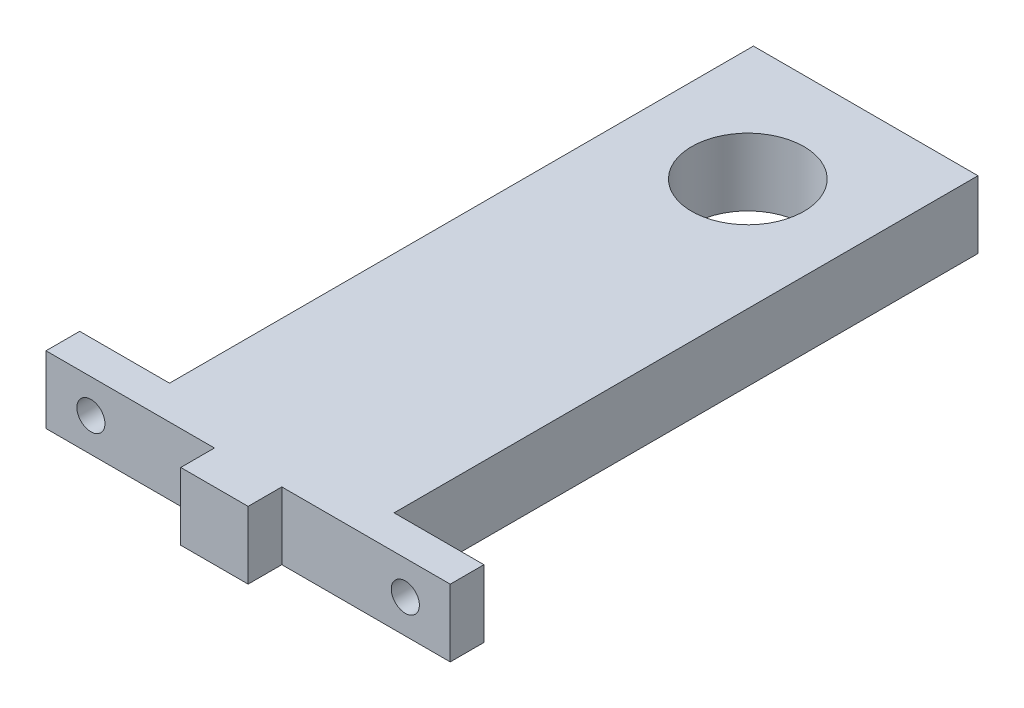
from build123d import *

# Parameters (mm, degrees)
EXTRUDE_1_DEPTH          = 6
SKETCH_3_R               = 5
CUT_EXTRUDE_1_DEPTH      = 42.909697148
CUT_EXTRUDE_3_DEPTH      = 42.909697148
CUT_EXTRUDE_3_DEPTH_BACK = 42.909697148
SKETCH_4_R               = 1.25


with BuildPart() as part:
    # 草图1 → 凸台-拉伸1 (new body)
    with BuildSketch(Plane(origin=(0, 0, 0), x_dir=(1, 0, 0), z_dir=(0, 1, 0))):
        Polygon((-10, 37.368739811), (10, 37.368739811), (10, -14.631260189), (18, -14.631260189), (18, -17.631260189), (3, -17.631260189), (3, -20.631260189), (-3, -20.631260189), (-3, -17.631260189), (-18, -17.631260189), (-18, -14.631260189), (-10, -14.631260189), align=None)
    extrude(amount=EXTRUDE_1_DEPTH)

    # 草图3 → 切除-拉伸1 (cut, through all)
    with BuildSketch(Plane.XZ):
        with Locations(Location((0, -26.868739811, 0), (0, 0, 270))):
            Circle(SKETCH_3_R)
    extrude(amount=-CUT_EXTRUDE_1_DEPTH, mode=Mode.SUBTRACT)

    # 草图4 → 切除-拉伸3 (cut, two sides: drawn at the far end of the back side and taken through both)
    with BuildSketch(Plane.XY.offset(-CUT_EXTRUDE_3_DEPTH_BACK)):
        with Locations((-14, 3)):
            Circle(SKETCH_4_R)
        with Locations((14, 3)):
            Circle(SKETCH_4_R)
    extrude(amount=CUT_EXTRUDE_3_DEPTH + CUT_EXTRUDE_3_DEPTH_BACK, mode=Mode.SUBTRACT)


solid = part.part
